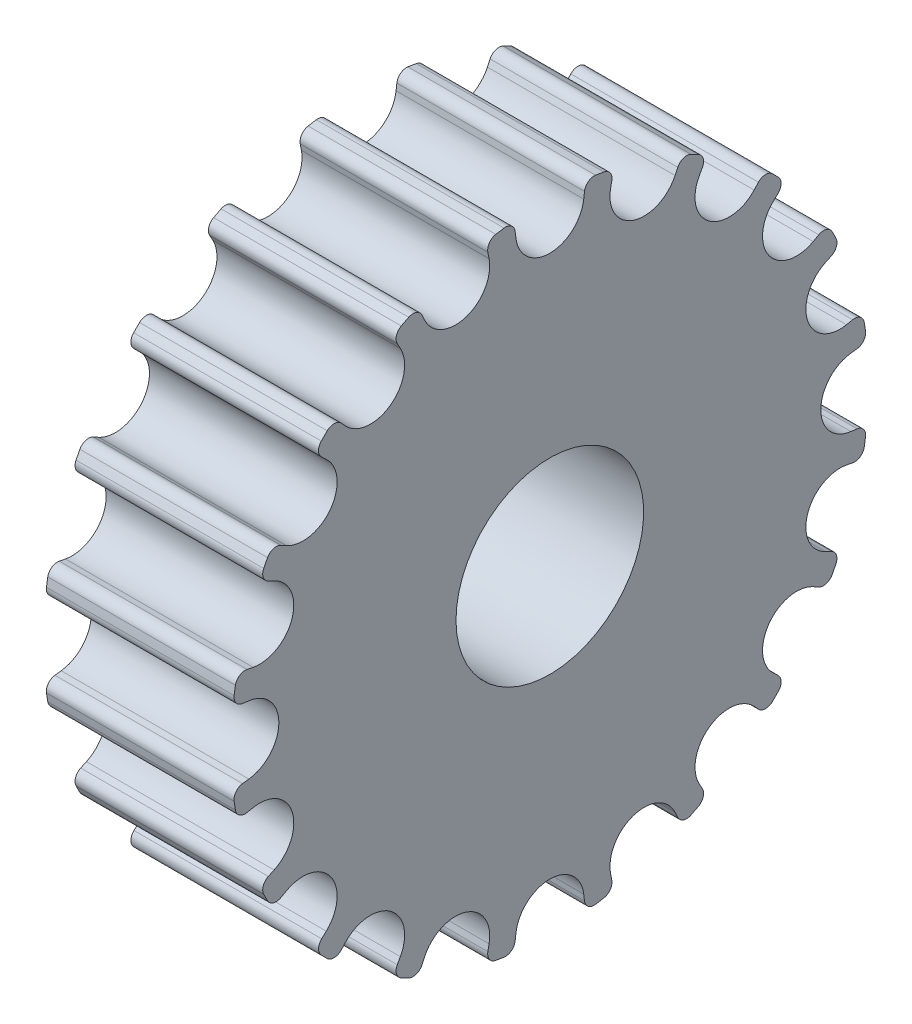
from build123d import *

# Parameters (mm, degrees)
CHAMFER_1_SIZE           = 1
SKETCH_4_W               = 2
SKETCH_4_H               = 1
CUT_EXTRUDE_1_DEPTH      = 24.334523779
CUT_EXTRUDE_2_REACH      = 25.335
PATTERN_CIRCULAR_3_COUNT = 20
SKETCH_7_R               = 2.8338
CUT_EXTRUDE_3_DEPTH      = 24.27268664
SKETCH_8_R               = 3.6676
CUT_EXTRUDE_4_DEPTH      = 15
SKETCH_9_R               = 2.8338
SKETCH_9_R_2             = 2.5
EXTRUDE_1_DEPTH          = 5


with BuildPart() as part:
    # 草图1 → 旋转1 (revolve)
    with BuildSketch(Plane.XY, mode=Mode.PRIVATE) as revolve_1_sk:
        Polygon((0, 1.8338), (0, 8.5), (5, 8.5), (5, 3.6676), (20, 3.6676), (20, 1.8338), align=None)
    revolve(revolve_1_sk.sketch.rotate(Axis((0, 0, 0), (1, 0, 0)), 90), axis=Axis((0, 0, 0), (1, 0, 0)))

    # 倒角1
    chamfer_1_edges = [part.edges().sort_by_distance(p)[0] for p in [
        (20, 0, -1.8338),
        (0, 0, -1.8338),
    ]]
    chamfer(chamfer_1_edges, length=CHAMFER_1_SIZE)

    # 草图4 → 切除-拉伸1 (cut, through all)
    with BuildSketch(Plane.ZY):
        with Locations((0, 2.037147501)):
            Rectangle(SKETCH_4_W, SKETCH_4_H)
    extrude(amount=-CUT_EXTRUDE_1_DEPTH, mode=Mode.SUBTRACT)

    # 草图6 → 切除-拉伸2 (cut, up to next)
    with BuildSketch(Plane(origin=(0, 0, 0), x_dir=(0, 0, -1), z_dir=(1, 0, 0)), mode=Mode.PRIVATE) as cut_extrude_2_sk1:
        with BuildLine():
            Line((0.923770376, 8.186492725), (0.903216998, 8.019098898))
            ThreePointArc((0.903216998, 8.019098898), (0, 7.22), (-0.903216998, 8.019098898))
            Line((-0.903216998, 8.019098898), (-0.923770376, 8.186492725))
            ThreePointArc((-0.923770376, 8.186492725), (-1.023997868, 8.36141809), (-1.219123202, 8.412118557))
            ThreePointArc((-1.219123202, 8.412118557), (-1.347636542, 8.392489246), (-1.475834638, 8.370896733))
            Line((-1.475834638, 8.370896733), (-1.672482627, 9.972466076))
            ThreePointArc((-1.672482627, 9.972466076), (0, 10.111739601), (1.672482627, 9.972466076))
            Line((1.672482627, 9.972466076), (1.475834638, 8.370896733))
            ThreePointArc((1.475834638, 8.370896733), (1.347636542, 8.392489246), (1.219123202, 8.412118557))
            ThreePointArc((1.219123202, 8.412118557), (1.023997868, 8.36141809), (0.923770376, 8.186492725))
        make_face()
    cut_extrude_2_tool1 = extrude(cut_extrude_2_sk1.sketch, amount=CUT_EXTRUDE_2_REACH, mode=Mode.PRIVATE) & part.part
    cut_extrude_2 = cut_extrude_2_tool1.solids().sort_by_distance((0, 8.902144, 0))[0]
    add(cut_extrude_2, mode=Mode.SUBTRACT)

    # 阵列(圆周)3: 切除-拉伸2 ×20 about axis
    pattern_circular_3_axis = Axis((0, 0, 0), (1, 0, 0))
    for i in range(1, PATTERN_CIRCULAR_3_COUNT):
        add(cut_extrude_2.rotate(pattern_circular_3_axis, i * 360 / PATTERN_CIRCULAR_3_COUNT), mode=Mode.SUBTRACT)

    # 草图7 → 切除-拉伸3 (cut, through all)
    with BuildSketch(Plane.ZY):
        Circle(SKETCH_7_R)
    extrude(amount=-CUT_EXTRUDE_3_DEPTH, mode=Mode.SUBTRACT)

    # 草图8 → 切除-拉伸4 (cut)
    with BuildSketch(Plane(origin=(20, 0, 0), x_dir=(0, 0, -1), z_dir=(1, 0, 0))):
        Circle(SKETCH_8_R)
    extrude(amount=-CUT_EXTRUDE_4_DEPTH, mode=Mode.SUBTRACT)

    # 草图9 → 凸台-拉伸1 (add)
    with BuildSketch(Plane.ZY):
        Circle(SKETCH_9_R)
        Circle(SKETCH_9_R_2, mode=Mode.SUBTRACT)
    extrude(amount=-EXTRUDE_1_DEPTH)


solid = part.part
